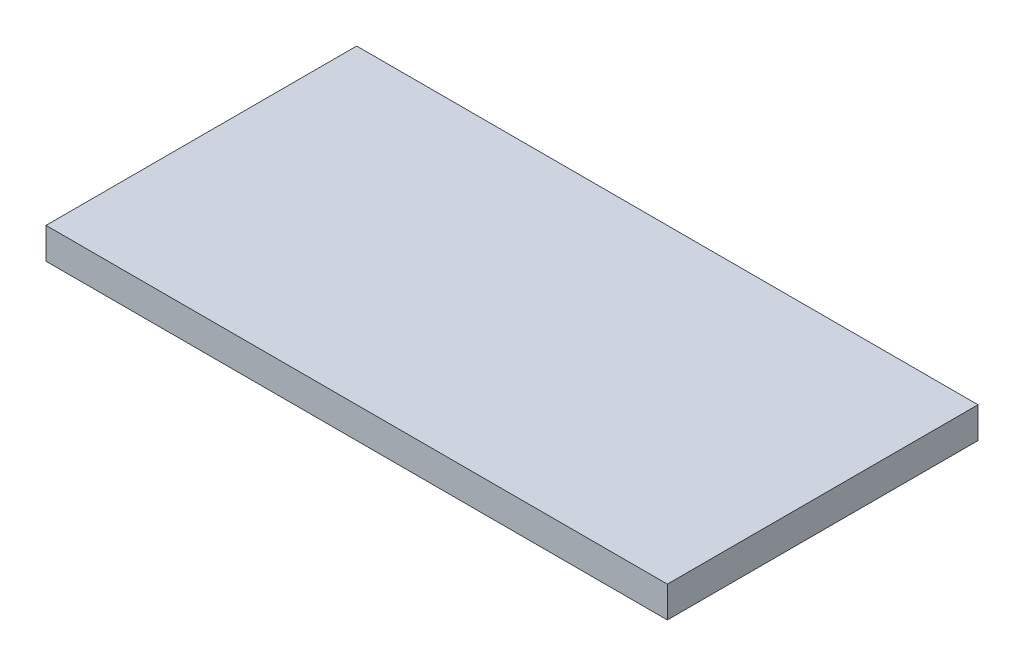
from build123d import *

# Parameters (mm, degrees)
SKETCH1_W           = 200
SKETCH1_H           = 100
BOSS_EXTRUDE1_DEPTH = 10


with BuildPart() as part:
    # Sketch1 → Boss-Extrude1 (new body)
    with BuildSketch(Plane(origin=(0, 0, 0), x_dir=(1, 0, 0), z_dir=(0, 1, 0))):
        Rectangle(SKETCH1_W, SKETCH1_H)
    extrude(amount=BOSS_EXTRUDE1_DEPTH)


solid = part.part
